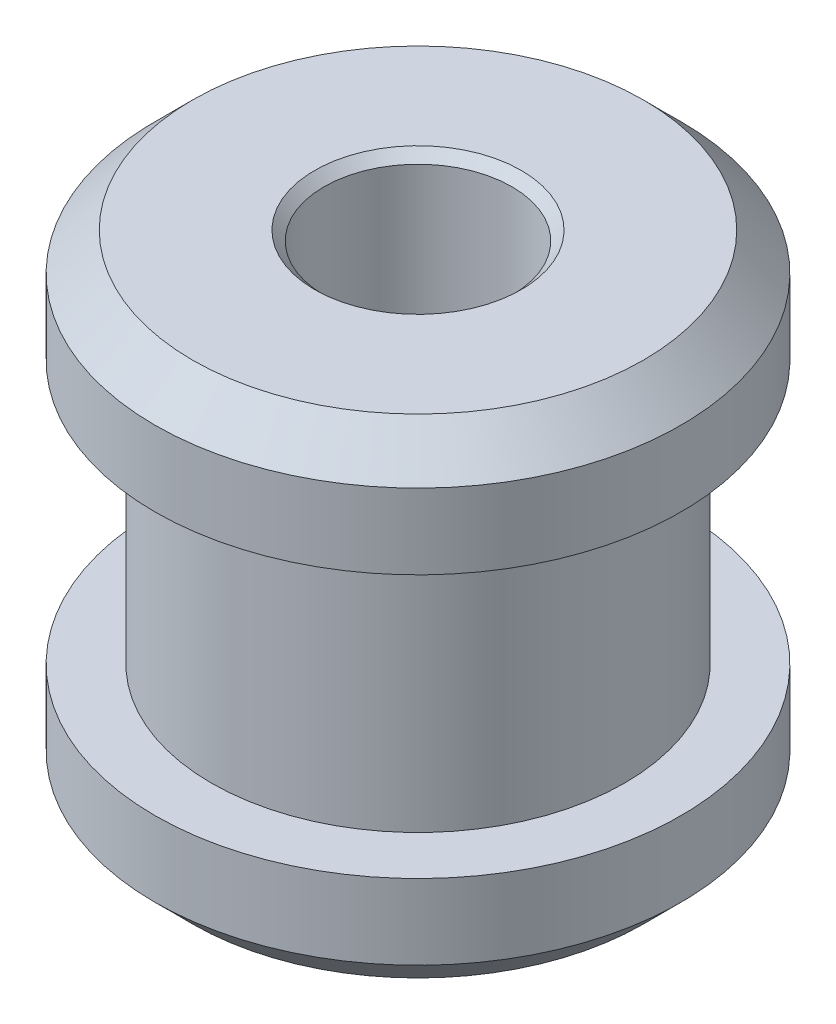
from build123d import *

# Parameters (mm, degrees)
SKETCH2_R                = 5.500000001
BOSS_EXTRUDE2_DEPTH      = 3.5
SKETCH3_R                = 7.000000001
BOSS_EXTRUDE3_DEPTH      = 3
CHAMFER1_SIZE            = 1
CHAMFER1_OF_MIRROR1_SIZE = 1
CUT_EXTRUDE1_DEPTH       = 12.842719284
CUT_EXTRUDE1_DEPTH_BACK  = 12.842719284
SKETCH4_R                = 2.5
CHAMFER2_SIZE            = 0.25


with BuildPart() as part:
    # Sketch2 → Boss-Extrude2 (new, symmetric)
    with BuildSketch(Plane.XZ):
        with Locations(Location((0, 0, 0), (0, 0, 270))):
            Circle(SKETCH2_R)
    extrude(amount=BOSS_EXTRUDE2_DEPTH, both=True)

    # Sketch3 → Boss-Extrude3 (add)
    with BuildSketch(Plane(origin=(0, -3.5, 0), x_dir=(1, 0, 0), z_dir=(0, 1, 0))):
        with Locations(Location((0, 0, 0), (0, 0, 90))):
            Circle(SKETCH3_R)
    boss_extrude3 = extrude(amount=-BOSS_EXTRUDE3_DEPTH)

    # Chamfer1
    chamfer1_edges = [part.edges().sort_by_distance(p)[0] for p in [
        (0, -6.5, 7.000000001),
    ]]
    chamfer(chamfer1_edges, length=CHAMFER1_SIZE)

    # Mirror1: Boss-Extrude3 across plane
    add(boss_extrude3.mirror(Plane.ZX))

    # Chamfer1 of Mirror1
    chamfer1_of_mirror1_edges = [part.edges().sort_by_distance(p)[0] for p in [
        (0, 6.5, 7.000000001),
    ]]
    chamfer(chamfer1_of_mirror1_edges, length=CHAMFER1_OF_MIRROR1_SIZE)

    # Sketch4 → Cut-Extrude1 (cut, two sides: drawn at the far end of the back side and taken through both)
    with BuildSketch(Plane(origin=(0, 0, 0), x_dir=(-1, 0, 0), z_dir=(0, 1, 0)).offset(-CUT_EXTRUDE1_DEPTH_BACK)):
        with Locations(Location((0, 0, 0), (0, 0, 270))):
            Circle(SKETCH4_R)
    extrude(amount=CUT_EXTRUDE1_DEPTH + CUT_EXTRUDE1_DEPTH_BACK, mode=Mode.SUBTRACT)

    # Chamfer2
    chamfer2_edges = [part.edges().sort_by_distance(p)[0] for p in [
        (0, -6.5, 2.5),
        (0, 6.5, 2.5),
    ]]
    chamfer(chamfer2_edges, length=CHAMFER2_SIZE)


solid = part.part
